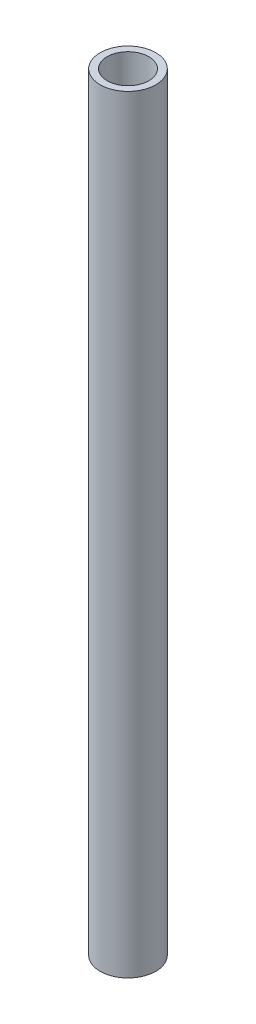
from build123d import *

# Parameters (mm, degrees)
SKETCH1_R           = 12.7
SKETCH1_R_2         = 9.525
BOSS_EXTRUDE2_DEPTH = 350.52


with BuildPart() as part:
    # Sketch1 → Boss-Extrude2 (new body)
    with BuildSketch(Plane(origin=(0, 0, 0), x_dir=(1, 0, 0), z_dir=(0, 1, 0))):
        with Locations(Location((-391.181668083, 212.743279788, 0), (0, 0, 270))):
            Circle(SKETCH1_R)
        with Locations(Location((-391.181668083, 212.743279788, 0), (0, 0, 270))):
            Circle(SKETCH1_R_2, mode=Mode.SUBTRACT)
    extrude(amount=BOSS_EXTRUDE2_DEPTH)


solid = part.part
